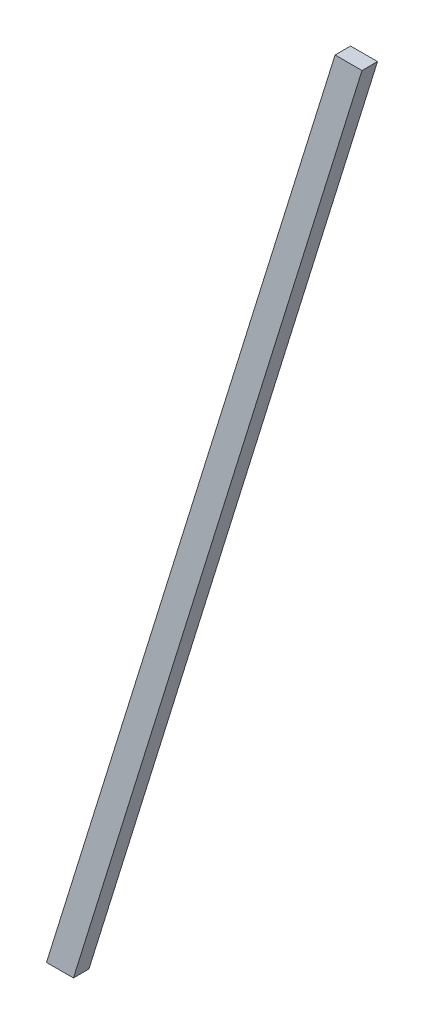
from build123d import *

# Parameters (mm, degrees)
BOSS_EXTRUDE1_DEPTH = 10


with BuildPart() as part:
    # Sketch1 → Boss-Extrude1 (new body)
    with BuildSketch(Plane.XY):
        Polygon((5.677498633, 548.465572612), (23.060751451, 548.465572612), (-163.09093689, -51.534427388), (-180.474189708, -51.534427388), align=None)
    extrude(amount=BOSS_EXTRUDE1_DEPTH)


solid = part.part
